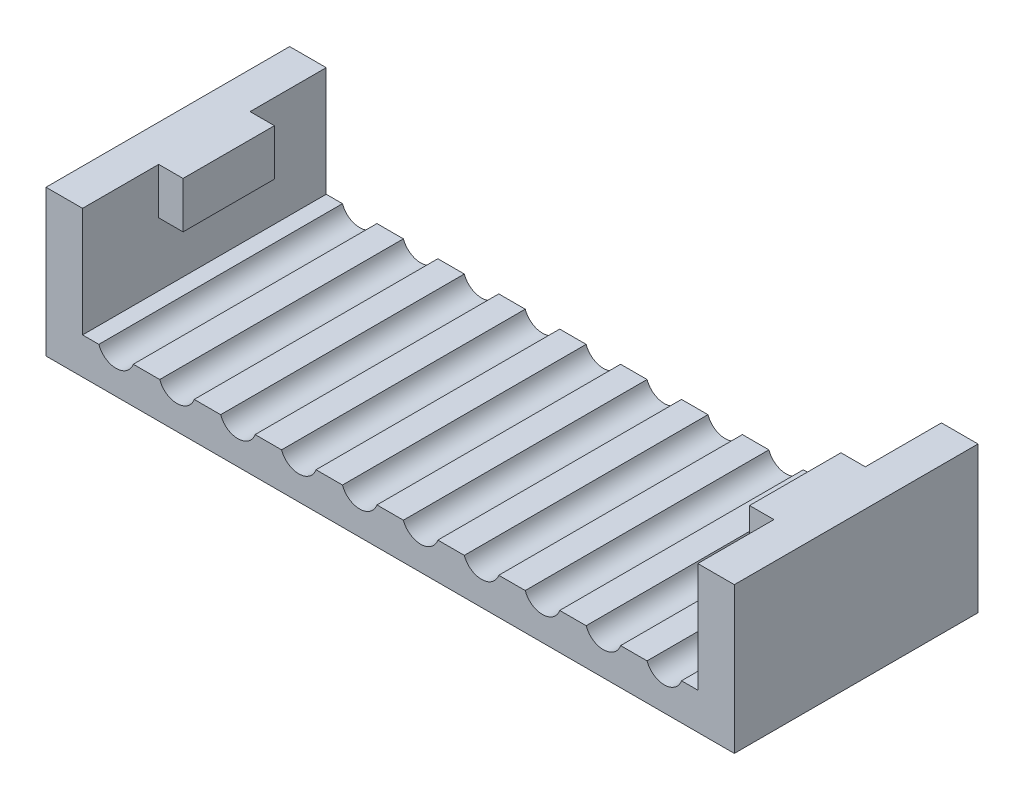
from build123d import *

# Parameters (mm, degrees)
BOSS_EXTRUDE1_DEPTH = 10
SKETCH3_R           = 0.75
CUT_EXTRUDE1_DEPTH  = 19.317085603
SKETCH4_W           = 3.75
SKETCH4_H           = 1.9
BOSS_EXTRUDE2_DEPTH = 1


with BuildPart() as part:
    # Sketch2 → Boss-Extrude1 (new body)
    with BuildSketch(Plane.XY):
        Polygon((-12.625, 6), (-14.125, 6), (-14.125, 0), (14.125, 0), (14.125, 6), (12.625, 6), (12.625, 1.5), (-12.625, 1.5), align=None)
    extrude(amount=BOSS_EXTRUDE1_DEPTH)

    # Sketch3 → Cut-Extrude1 (cut, through all)
    with BuildSketch(Plane.XY.offset(10)):
        with Locations((-11.25, 1.75)):
            Circle(SKETCH3_R)
        with Locations((-8.75, 1.75)):
            Circle(SKETCH3_R)
        with Locations((-6.25, 1.75)):
            Circle(SKETCH3_R)
        with Locations((-3.75, 1.75)):
            Circle(SKETCH3_R)
        with Locations((-1.25, 1.75)):
            Circle(SKETCH3_R)
        with Locations((1.25, 1.75)):
            Circle(SKETCH3_R)
        with Locations((3.75, 1.75)):
            Circle(SKETCH3_R)
        with Locations((6.25, 1.75)):
            Circle(SKETCH3_R)
        with Locations((8.75, 1.75)):
            Circle(SKETCH3_R)
        with Locations((11.25, 1.75)):
            Circle(SKETCH3_R)
    extrude(amount=-CUT_EXTRUDE1_DEPTH, mode=Mode.SUBTRACT)

    # Sketch4 → Boss-Extrude2 (add)
    with BuildSketch(Plane(origin=(-12.625, 0, 0), x_dir=(0, 0, -1), z_dir=(1, 0, 0))):
        with Locations((-5, 5.05)):
            Rectangle(SKETCH4_W, SKETCH4_H)
    boss_extrude2 = extrude(amount=BOSS_EXTRUDE2_DEPTH)

    # Mirror1: Boss-Extrude2 across plane
    add(boss_extrude2.mirror(Plane.ZY))


solid = part.part
